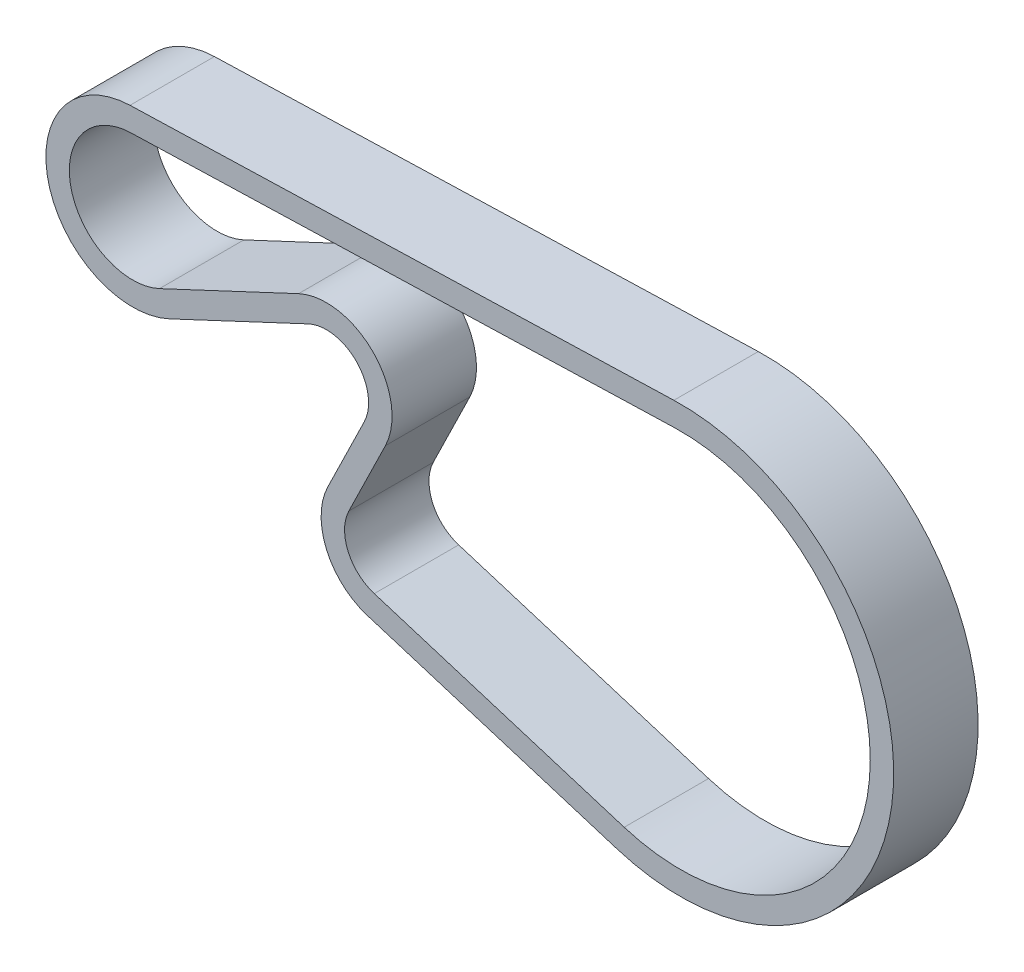
from build123d import *

# Parameters (mm, degrees)
EXTRUDE_THIN1_DEPTH      = 28
EXTRUDE_THIN1_DEPTH_BACK = 8


with BuildPart() as part:
    # Sketch1 → Extrude-Thin1 (new, two sides: drawn at the far end of the back side and taken through both)
    with BuildSketch(Plane.XY.offset(-EXTRUDE_THIN1_DEPTH_BACK)):
        with BuildLine():
            Line((75.09763305, -56.636175287), (15.779972756, -84.433510373))
            ThreePointArc((15.779972756, -84.433510373), (-35.90985371, -59.518404132), (-1.041096203, -13.946807397))
            Line((-1.041096203, -13.946807397), (230.948755637, -6.917199265))
            ThreePointArc((230.948755637, -6.917199265), (323.876631062, -110.125411065), (206.782861721, -184.801874528))
            Line((206.782861721, -184.801874528), (100.191052218, -151.789239227))
            ThreePointArc((100.191052218, -151.789239227), (82.773150037, -136.152427225), (83.316648222, -112.75161921))
            Line((83.316648222, -112.75161921), (98.908753856, -80.836636907))
            ThreePointArc((98.908753856, -80.836636907), (95.566396379, -60.310969319), (75.09763305, -56.636175287))
        make_face()
        with BuildLine():
            Line((70.854272788, -47.58112732), (11.536612494, -75.378462406))
            ThreePointArc((11.536612494, -75.378462406), (-26.182990603, -57.197168663), (-0.738221611, -23.942219694))
            Line((-0.738221611, -23.942219694), (231.251630228, -16.912611562))
            ThreePointArc((231.251630228, -16.912611562), (313.967651211, -108.779261625), (209.74132905, -175.249520313))
            Line((209.74132905, -175.249520313), (103.149519547, -142.236885012))
            ThreePointArc((103.149519547, -142.236885012), (91.952296716, -132.184648724), (92.301688407, -117.141272143))
            Line((92.301688407, -117.141272143), (107.893794041, -85.22628984))
            ThreePointArc((107.893794041, -85.22628984), (102.6945713, -53.297473593), (70.854272788, -47.58112732))
        make_face(mode=Mode.SUBTRACT)
    extrude(amount=EXTRUDE_THIN1_DEPTH + EXTRUDE_THIN1_DEPTH_BACK)


solid = part.part
